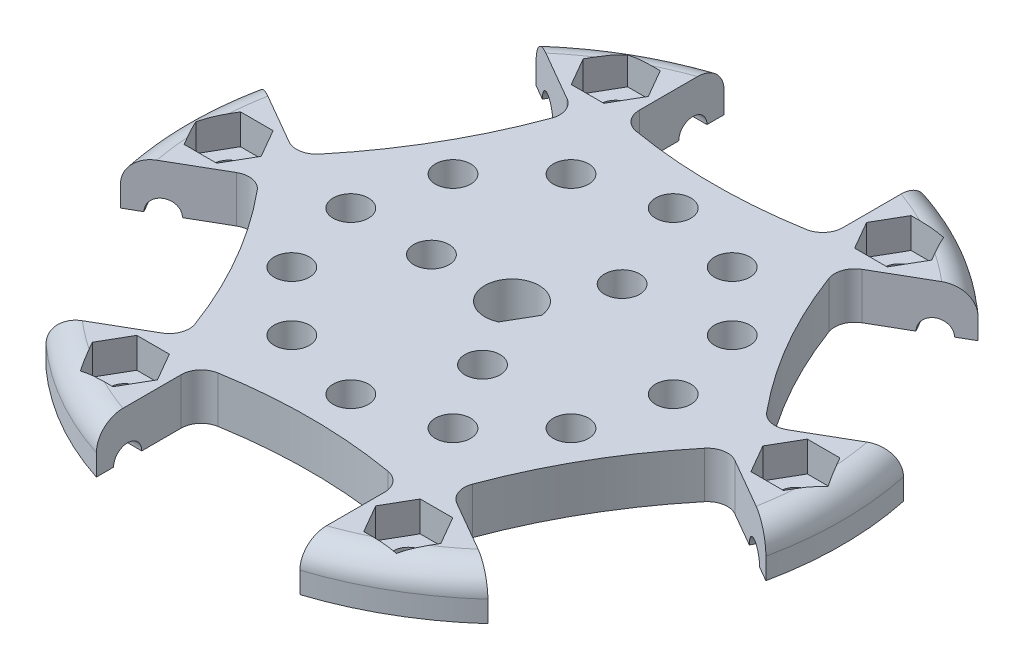
from build123d import *

# Parameters (mm, degrees)
CORTE_EXTRUS_O2_DEPTH  = 10
ESBO_O5_W              = 25.2
ESBO_O5_H              = 1.4
ESBO_O10_W             = 25.2
ESBO_O10_H             = 1.4
ESBO_O12_R             = 1.75
ESBO_O12_R_2           = 1.3
CORTE_EXTRUS_O9_DEPTH  = 46.434293366
ESBO_O17_R             = 1.75
CORTE_EXTRUS_O10_DEPTH = 46.434293366
CORTE_EXTRUS_O11_DEPTH = 46.434293366
CORTE_EXTRUS_O12_DEPTH = 3
ESBO_O19_R             = 1.5
CORTE_EXTRUS_O13_DEPTH = 46.434293366
CORTE_EXTRUS_O14_DEPTH = 3
CORTE_EXTRUS_O15_DEPTH = 46.434293366


with BuildPart() as part:
    # Esboço1 → Revolução3 (revolve)
    with BuildSketch(Plane.XY, mode=Mode.PRIVATE) as revolu_o3_sk:
        with BuildLine():
            Line((-32.75, 2.1), (-32.75, 0))
            Line((-32.75, 0), (0, 0))
            Line((0, 0), (0, 4.6))
            Line((0, 4.6), (-6.07, 4.6))
            Line((-6.07, 4.6), (-30.25, 4.6))
            ThreePointArc((-30.25, 4.6), (-32.017766953, 3.867766953), (-32.75, 2.1))
        make_face()
    revolve(revolu_o3_sk.sketch.rotate(Axis((0, 0, 0), (0, 1, 0)), 270), axis=Axis((0, 0, 0), (0, 1, 0)))

    # Esboço3 → Corte-extrusão2 (cut)
    with BuildSketch(Plane.XZ):
        with BuildLine():
            Line((-10.1, 71.55), (10.1, 71.55))
            Line((10.1, 71.55), (10.1, 22.738373522))
            ThreePointArc((10.1, 22.738373522), (9.628888485, 21.448993826), (8.4375, 20.767055752))
            ThreePointArc((8.4375, 20.767055752), (0, 20.05), (-8.4375, 20.767055752))
            ThreePointArc((-8.4375, 20.767055752), (-9.628888485, 21.448993826), (-10.1, 22.738373522))
            Line((-10.1, 22.738373522), (-10.1, 71.55))
        make_face()
        with BuildLine():
            Line((10.1, -71.55), (-10.1, -71.55))
            Line((-10.1, -71.55), (-10.1, -22.738373522))
            ThreePointArc((-10.1, -22.738373522), (-9.628888485, -21.448993826), (-8.4375, -20.767055752))
            ThreePointArc((-8.4375, -20.767055752), (0, -20.05), (8.4375, -20.767055752))
            ThreePointArc((8.4375, -20.767055752), (9.628888485, -21.448993826), (10.1, -22.738373522))
            Line((10.1, -22.738373522), (10.1, -71.55))
        make_face()
        with BuildLine():
            Line((56.914117641, 44.521856578), (67.014117641, 27.028143422))
            Line((67.014117641, 27.028143422), (24.742009111, 2.622330183))
            ThreePointArc((24.742009111, 2.622330183), (23.389817782, 2.385634875), (22.203547843, 3.076438532))
            ThreePointArc((22.203547843, 3.076438532), (17.363809346, 10.025), (13.766047843, 17.69061722))
            ThreePointArc((13.766047843, 17.69061722), (13.760929296, 19.063358951), (14.642009111, 20.116043339))
            Line((14.642009111, 20.116043339), (56.914117641, 44.521856578))
        make_face()
        with BuildLine():
            Line((-56.914117641, -44.521856578), (-67.014117641, -27.028143422))
            Line((-67.014117641, -27.028143422), (-24.742009111, -2.622330183))
            ThreePointArc((-24.742009111, -2.622330183), (-23.389817782, -2.385634875), (-22.203547843, -3.076438532))
            ThreePointArc((-22.203547843, -3.076438532), (-17.363809346, -10.025), (-13.766047843, -17.69061722))
            ThreePointArc((-13.766047843, -17.69061722), (-13.760929296, -19.063358951), (-14.642009111, -20.116043339))
            Line((-14.642009111, -20.116043339), (-56.914117641, -44.521856578))
        make_face()
        with BuildLine():
            Line((-67.014117641, 27.028143422), (-56.914117641, 44.521856578))
            Line((-56.914117641, 44.521856578), (-14.642009111, 20.116043339))
            ThreePointArc((-14.642009111, 20.116043339), (-13.760929296, 19.063358951), (-13.766047843, 17.69061722))
            ThreePointArc((-13.766047843, 17.69061722), (-17.363809346, 10.025), (-22.203547843, 3.076438532))
            ThreePointArc((-22.203547843, 3.076438532), (-23.389817782, 2.385634875), (-24.742009111, 2.622330183))
            Line((-24.742009111, 2.622330183), (-67.014117641, 27.028143422))
        make_face()
        with BuildLine():
            Line((67.014117641, -27.028143422), (56.914117641, -44.521856578))
            Line((56.914117641, -44.521856578), (14.642009111, -20.116043339))
            ThreePointArc((14.642009111, -20.116043339), (13.760929296, -19.063358951), (13.766047843, -17.69061722))
            ThreePointArc((13.766047843, -17.69061722), (17.363809346, -10.025), (22.203547843, -3.076438532))
            ThreePointArc((22.203547843, -3.076438532), (23.389817782, -2.385634875), (24.742009111, -2.622330183))
            Line((24.742009111, -2.622330183), (67.014117641, -27.028143422))
        make_face()
    extrude(amount=-CORTE_EXTRUS_O2_DEPTH, mode=Mode.SUBTRACT)

    # Esboço5 → Corte-Revolução3 (revolve, cut)
    with BuildSketch(Plane.XZ):
        with Locations((0, 27.35)):
            Rectangle(ESBO_O5_W, ESBO_O5_H)
    revolve(axis=Axis((-12.6, 0, 28.05), (1, 0, 0)), mode=Mode.SUBTRACT)

    # Esboço6 → Corte-Revolução4 (revolve, cut)
    with BuildSketch(Plane.XZ):
        Polygon((-29.379577011, 2.413079912), (-16.779577011, 24.236920088), (-17.992012576, 24.936920088), (-30.592012576, 3.113079912), align=None)
    revolve(axis=Axis((-30.592012576, 0, 3.113079912), (0.49999999999999983, 0, 0.8660254037844388)), mode=Mode.SUBTRACT)

    # Esboço7 → Corte-Revolução5 (revolve, cut)
    with BuildSketch(Plane.XZ):
        Polygon((-16.779577011, -24.236920088), (-29.379577011, -2.413079912), (-30.592012576, -3.113079912), (-17.992012576, -24.936920088), align=None)
    revolve(axis=Axis((-17.992012576, 0, -24.936920088), (-0.4999999999999998, 0, 0.8660254037844388)), mode=Mode.SUBTRACT)

    # Esboço8 → Corte-Revolução6 (revolve, cut)
    with BuildSketch(Plane.XZ):
        Polygon((16.779577011, 24.236920088), (29.379577011, 2.413079912), (30.592012576, 3.113079912), (17.992012576, 24.936920088), align=None)
    revolve(axis=Axis((17.992012576, 0, 24.936920088), (0.5000000000000001, 0, -0.8660254037844386)), mode=Mode.SUBTRACT)

    # Esboço10 → Corte-Revolução7 (revolve, cut)
    with BuildSketch(Plane.XZ):
        with Locations((0, -27.35)):
            Rectangle(ESBO_O10_W, ESBO_O10_H)
    revolve(axis=Axis((12.6, 0, -28.05), (-1, 0, 0)), mode=Mode.SUBTRACT)

    # Esboço11 → Corte-Revolução8 (revolve, cut)
    with BuildSketch(Plane.XZ):
        Polygon((29.379577011, -2.413079912), (16.779577011, -24.236920088), (17.992012576, -24.936920088), (30.592012576, -3.113079912), align=None)
    revolve(axis=Axis((30.592012576, 0, -3.113079912), (-0.49999999999999994, 0, -0.8660254037844387)), mode=Mode.SUBTRACT)

    # Esboço12 → Corte-extrusão9 (cut, through all)
    with BuildSketch(Plane.XZ):
        with Locations(Location((0, 16, 0), (0, 0, 270))):
            Circle(ESBO_O12_R)
        with Locations(Location((-8, 13.856406461, 0), (0, 0, 270))):
            Circle(ESBO_O12_R)
        with Locations(Location((-13.856406461, 8, 0), (0, 0, 270))):
            Circle(ESBO_O12_R)
        with Locations(Location((-16, 0, 0), (0, 0, 270))):
            Circle(ESBO_O12_R)
        with Locations(Location((-13.856406461, -8, 0), (0, 0, 270))):
            Circle(ESBO_O12_R)
        with Locations(Location((-8, -13.856406461, 0), (0, 0, 270))):
            Circle(ESBO_O12_R)
        with Locations(Location((0, -16, 0), (0, 0, 270))):
            Circle(ESBO_O12_R)
        with Locations(Location((8, -13.856406461, 0), (0, 0, 270))):
            Circle(ESBO_O12_R)
        with Locations(Location((13.856406461, -8, 0), (0, 0, 270))):
            Circle(ESBO_O12_R)
        with Locations(Location((16, 0, 0), (0, 0, 270))):
            Circle(ESBO_O12_R)
        with Locations(Location((13.856406461, 8, 0), (0, 0, 270))):
            Circle(ESBO_O12_R)
        with Locations(Location((8, 13.856406461, 0), (0, 0, 270))):
            Circle(ESBO_O12_R)
        with Locations(Location((28.129577011, 0, 0), (0, 0, 270))):
            Circle(ESBO_O12_R_2)
        with Locations(Location((14.064788505, 24.360928289, 0), (0, 0, 270))):
            Circle(ESBO_O12_R_2)
        with Locations(Location((-14.064788505, 24.360928289, 0), (0, 0, 270))):
            Circle(ESBO_O12_R_2)
        with Locations(Location((-28.129577011, 0, 0), (0, 0, 270))):
            Circle(ESBO_O12_R_2)
        with Locations(Location((14.064788505, -24.360928289, 0), (0, 0, 270))):
            Circle(ESBO_O12_R_2)
        with Locations(Location((-14.064788505, -24.360928289, 0), (0, 0, 270))):
            Circle(ESBO_O12_R_2)
    extrude(amount=-CORTE_EXTRUS_O9_DEPTH, mode=Mode.SUBTRACT)

    # Esboço17 → Corte-extrusão10 (cut, through all)
    with BuildSketch(Plane.XZ):
        with Locations(Location((4, 6.92820323, 0), (0, 0, 270))):
            Circle(ESBO_O17_R)
        with Locations(Location((-8, 0, 0), (0, 0, 270))):
            Circle(ESBO_O17_R)
        with Locations(Location((4, -6.92820323, 0), (0, 0, 270))):
            Circle(ESBO_O17_R)
    extrude(amount=-CORTE_EXTRUS_O10_DEPTH, mode=Mode.SUBTRACT)

    # Esboço13 → Corte-extrusão11 (cut, through all)
    with BuildSketch(Plane.XZ):
        with BuildLine():
            Line((2.585138834, -0.277591805), (1.052167862, 2.377591805))
            ThreePointArc((1.052167862, 2.377591805), (-2.25166605, -1.3), (2.585138834, -0.277591805))
        make_face()
    extrude(amount=-CORTE_EXTRUS_O11_DEPTH, mode=Mode.SUBTRACT)

    # Esboço18 → Corte-extrusão12 (cut)
    with BuildSketch(Plane(origin=(0, 4.6, 0), x_dir=(1, 0, 0), z_dir=(0, 1, 0))):
        Polygon((-31.016328357, 0), (-29.572952684, -2.5), (-26.686201338, -2.5), (-25.242825665, 0), (-26.686201338, 2.5), (-29.572952684, 2.5), align=None)
        Polygon((-15.508164178, 26.860928289), (-16.951539851, 24.360928289), (-15.508164178, 21.860928289), (-12.621412832, 21.860928289), (-11.178037159, 24.360928289), (-12.621412832, 26.860928289), align=None)
        Polygon((15.508164178, 26.860928289), (12.621412832, 26.860928289), (11.178037159, 24.360928289), (12.621412832, 21.860928289), (15.508164178, 21.860928289), (16.951539851, 24.360928289), align=None)
        Polygon((31.016328357, 0), (29.572952684, 2.5), (26.686201338, 2.5), (25.242825665, 0), (26.686201338, -2.5), (29.572952684, -2.5), align=None)
        Polygon((15.508164178, -26.860928289), (16.951539851, -24.360928289), (15.508164178, -21.860928289), (12.621412832, -21.860928289), (11.178037159, -24.360928289), (12.621412832, -26.860928289), align=None)
        Polygon((-15.508164178, -26.860928289), (-12.621412832, -26.860928289), (-11.178037159, -24.360928289), (-12.621412832, -21.860928289), (-15.508164178, -21.860928289), (-16.951539851, -24.360928289), align=None)
    extrude(amount=-CORTE_EXTRUS_O12_DEPTH, mode=Mode.SUBTRACT)

    # Esboço19 → Corte-extrusão13 (cut, through all)
    with BuildSketch(Plane(origin=(0, 4.6, 0), x_dir=(1, 0, 0), z_dir=(0, 1, 0))):
        with Locations(Location((-14.064788505, 24.360928289, 0), (0, 0, 270))):
            Circle(ESBO_O19_R)
        with Locations(Location((14.064788505, 24.360928289, 0), (0, 0, 270))):
            Circle(ESBO_O19_R)
        with Locations(Location((14.064788505, -24.360928289, 0), (0, 0, 270))):
            Circle(ESBO_O19_R)
        with Locations(Location((-14.064788505, -24.360928289, 0), (0, 0, 270))):
            Circle(ESBO_O19_R)
        with Locations(Location((-28.129577011, 0, 0), (0, 0, 270))):
            Circle(ESBO_O19_R)
        with Locations(Location((28.129577011, 0, 0), (0, 0, 270))):
            Circle(ESBO_O19_R)
    extrude(amount=-CORTE_EXTRUS_O13_DEPTH, mode=Mode.SUBTRACT)

    # Esboço20 → Corte-extrusão14 (cut)
    with BuildSketch(Plane(origin=(0, 4.6, 0), x_dir=(1, 0, 0), z_dir=(0, 1, 0))):
        Polygon((26.512996257, -2.8), (29.746157765, -2.8), (31.362738518, 0), (29.746157765, 2.8), (26.512996257, 2.8), (24.896415503, 0), align=None)
        Polygon((-29.746157765, 2.8), (-31.362738518, 0), (-29.746157765, -2.8), (-26.512996257, -2.8), (-24.896415503, 0), (-26.512996257, 2.8), align=None)
        Polygon((15.681369259, 27.160928289), (12.448207752, 27.160928289), (10.831626998, 24.360928289), (12.448207752, 21.560928289), (15.681369259, 21.560928289), (17.297950013, 24.360928289), align=None)
        Polygon((-10.831626998, 24.360928289), (-12.448207752, 27.160928289), (-15.681369259, 27.160928289), (-17.297950013, 24.360928289), (-15.681369259, 21.560928289), (-12.448207752, 21.560928289), align=None)
        Polygon((-15.681369259, -27.160928289), (-12.448207752, -27.160928289), (-10.831626998, -24.360928289), (-12.448207752, -21.560928289), (-15.681369259, -21.560928289), (-17.297950013, -24.360928289), align=None)
        Polygon((17.297950013, -24.360928289), (15.681369259, -21.560928289), (12.448207752, -21.560928289), (10.831626998, -24.360928289), (12.448207752, -27.160928289), (15.681369259, -27.160928289), align=None)
    extrude(amount=-CORTE_EXTRUS_O14_DEPTH, mode=Mode.SUBTRACT)

    # Esboço21 → Corte-extrusão15 (cut, through all)
    with BuildSketch(Plane(origin=(0, 4.6, 0), x_dir=(1, 0, 0), z_dir=(0, 1, 0))):
        with BuildLine():
            Line((1.122632096, -2.455544171), (2.68787968, 0.255544171))
            ThreePointArc((2.68787968, 0.255544171), (-2.33826859, 1.35), (1.122632096, -2.455544171))
        make_face()
    extrude(amount=-CORTE_EXTRUS_O15_DEPTH, mode=Mode.SUBTRACT)


solid = part.part
